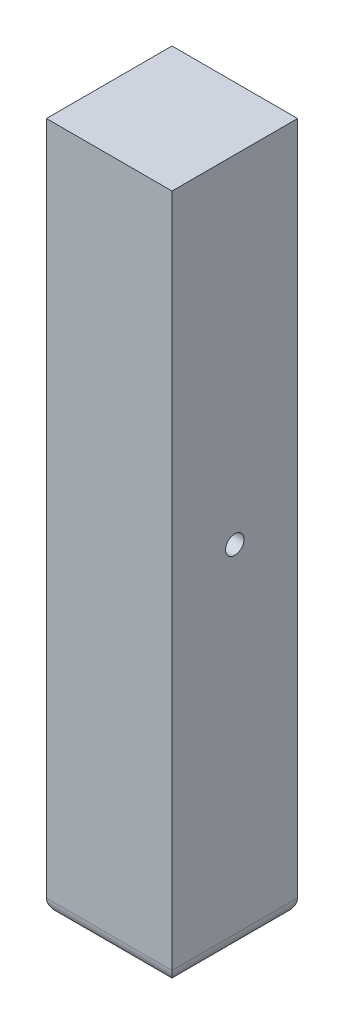
from build123d import *

# Parameters (mm, degrees)
SKETCH1_W           = 101.6
SKETCH1_H           = 558.8
BOSS_EXTRUDE1_DEPTH = 101.6
FILLET2_R           = 12.7


with BuildPart() as part:
    # Sketch1 → Boss-Extrude1 (new body)
    with BuildSketch(Plane.XY):
        with Locations((50.8, 279.4)):
            Rectangle(SKETCH1_W, SKETCH1_H)
    extrude(amount=BOSS_EXTRUDE1_DEPTH)

    # Fillet2
    fillet2_edges = [part.edges().sort_by_distance(p)[0] for p in [
        (50.8, 0, 0),
        (101.6, 0, 50.8),
        (0, 0, 50.8),
        (50.8, 0, 101.6),
    ]]
    fillet(fillet2_edges, radius=FILLET2_R)

    # Sketch8 → CBORE for M12 Hex Head Bolt1 (revolve, cut)
    with BuildSketch(Plane(origin=(0, 285.75, 50.8), x_dir=(0, 0, 1), z_dir=(0, 1, 0))):
        Polygon((0, 0), (0, 101.6), (7.5, 101.6), (7.5, 7.95), (11.89, 7.95), (11.89, 0.025), (11.915, 0), align=None)
    revolve(axis=Axis((-6.35, 285.75, 50.8), (1, 0, 0)), mode=Mode.SUBTRACT)


solid = part.part
